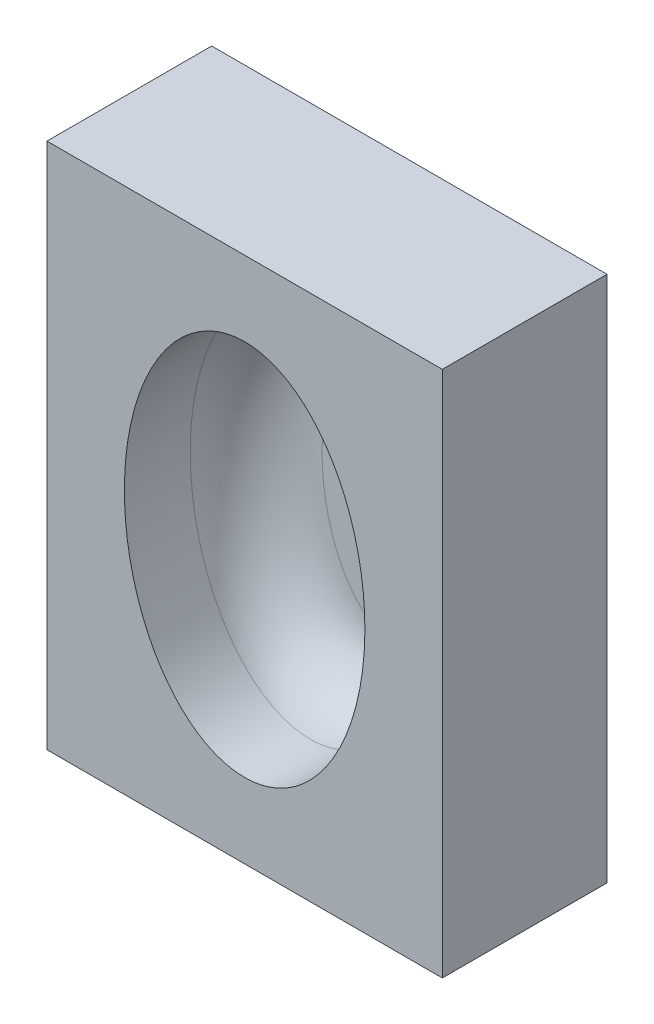
from build123d import *

# Parameters (mm, degrees)
SALIENTE_EXTRUIR1_DEPTH = 80
CROQUIS2_RX             = 28.641945325
CROQUIS2_RY             = 18.2521978
CORTAR_EXTRUIR1_DEPTH   = 20
REDONDEO1_R             = 10


with BuildPart() as part:
    # Croquis1 → Saliente-Extruir1 (new body)
    with BuildSketch(Plane(origin=(0, 0, 0), x_dir=(1, 0, 0), z_dir=(0, 1, 0))):
        Polygon((0, 0), (-30, 0), (-30, 25), (30, 25), (30, 0), align=None)
    extrude(amount=SALIENTE_EXTRUIR1_DEPTH)

    # Croquis2 → Cortar-Extruir1 (cut)
    with BuildSketch(Plane.XY):
        with Locations(Location((0, 40), (0, 0, 90))):
            Ellipse(CROQUIS2_RX, CROQUIS2_RY)
    extrude(amount=-CORTAR_EXTRUIR1_DEPTH, mode=Mode.SUBTRACT)

    # Redondeo1
    redondeo1_edges = [part.edges().sort_by_distance(p)[0] for p in [
        (0.027512659, 11.358087214, -20),
    ]]
    fillet(redondeo1_edges, radius=REDONDEO1_R)


solid = part.part
